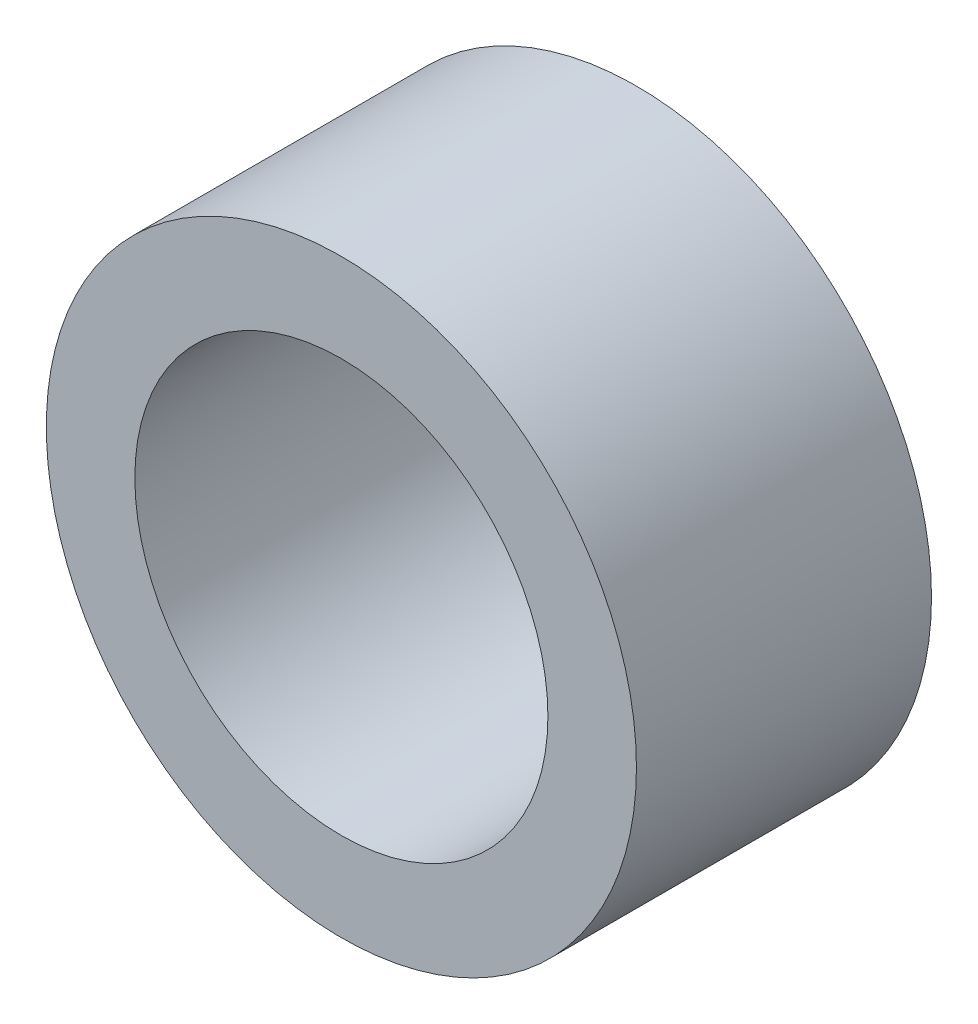
from build123d import *

# Parameters (mm, degrees)
SKETCH1_R    = 1.5
SKETCH1_R_2  = 1.05
SPACER_DEPTH = 1.5


with BuildPart() as part:
    # Sketch1 → Spacer (new body)
    with BuildSketch(Plane.XY):
        Circle(SKETCH1_R)
        Circle(SKETCH1_R_2, mode=Mode.SUBTRACT)
    extrude(amount=SPACER_DEPTH)


solid = part.part
